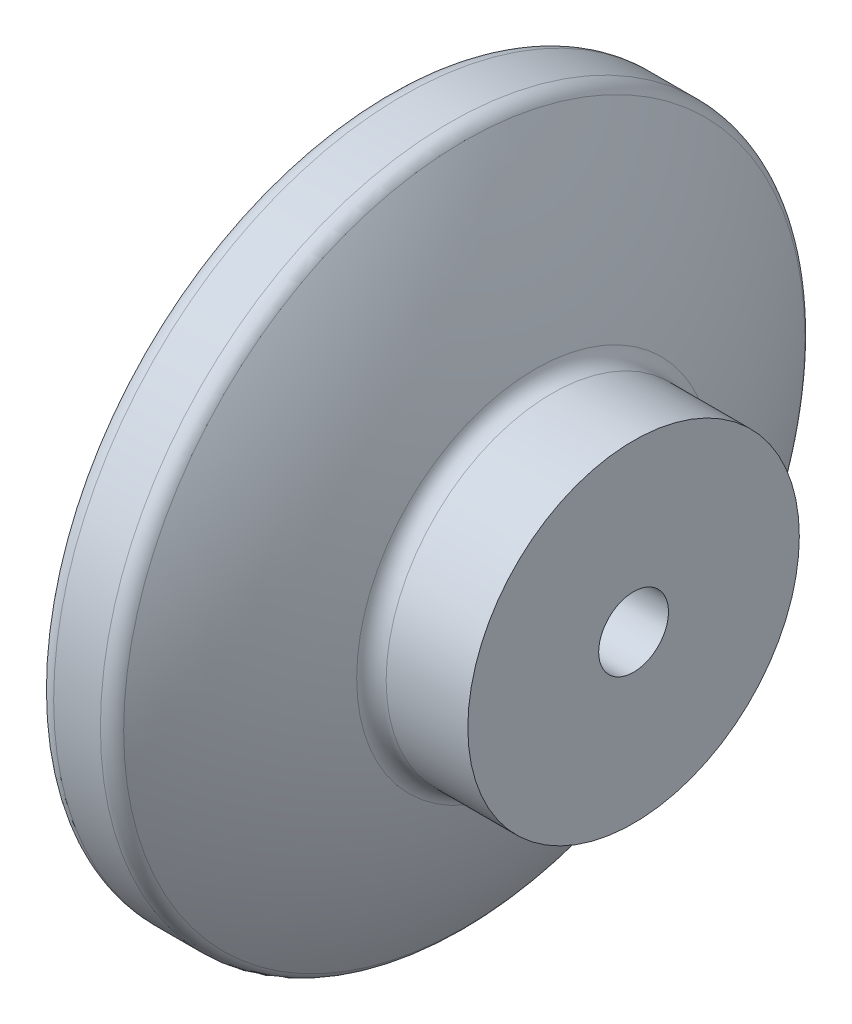
from build123d import *

# Parameters (mm, degrees)
FILLET_1_R          = 2
SKETCH_2_R          = 8
CUT_EXTRUDE_1_DEPTH = 70


with BuildPart() as part:
    # ｽｹｯﾁ1 → 回転1 (revolve)
    with BuildSketch(Plane.XY):
        with BuildLine():
            Line((64.893257373, 4), (83.442887702, 4))
            Line((83.442887702, 4), (83.442887702, 19))
            Line((83.442887702, 19), (72.553428589, 19))
            ThreePointArc((72.553428589, 19), (68.804066095, 29.849631301), (63.442887702, 40))
            Line((63.442887702, 40), (53.442887702, 40))
            ThreePointArc((53.442887702, 40), (61.471828426, 22.732746015), (64.893257373, 4))
        make_face()
    revolve(axis=Axis((-75, 0, 0), (1, 0, 0)))

    # ﾌｨﾚｯﾄ1
    fillet_1_edges = [part.edges().sort_by_distance(p)[0] for p in [
        (72.553428589, -19, 0),
        (53.442887702, -40, 0),
        (63.442887702, -40, 0),
    ]]
    fillet(fillet_1_edges, radius=FILLET_1_R)

    # ｽｹｯﾁ2 → ｶｯﾄ - 押し出し1 (cut)
    with BuildSketch(Plane(origin=(0, 0, 0), x_dir=(0, 0, -1), z_dir=(1, 0, 0))):
        with Locations(Location((0, 0, 0), (0, 0, 90))):
            Circle(SKETCH_2_R)
    extrude(amount=CUT_EXTRUDE_1_DEPTH, mode=Mode.SUBTRACT)


solid = part.part
